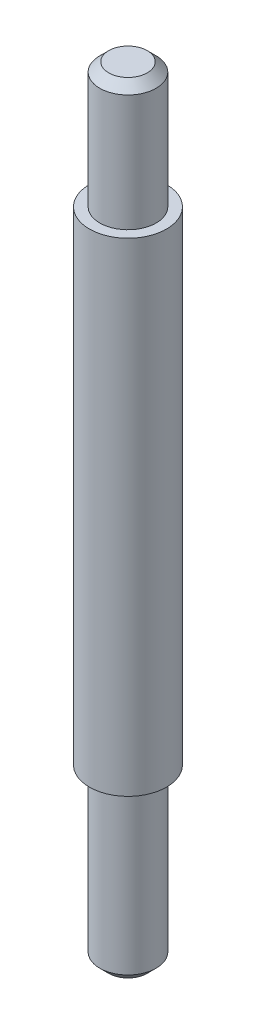
from build123d import *


with BuildPart() as part:
    # Sketch1 → Revolve1 (revolve)
    with BuildSketch(Plane(origin=(0, 0, 0), x_dir=(0, 0, -1), z_dir=(1, 0, 0))):
        Polygon((0, 1.400039432), (-0.065, 1.400039432), (-0.095, 1.370039432), (-0.095, 0.976440754), (-0.13, 0.976440754), (-0.13, -0.653559246), (-0.095, -0.653559246), (-0.095, -1.199960568), (-0.065, -1.229960568), (0, -1.229960568), align=None)
    revolve(axis=Axis((0, 1.400039432, 0), (0, -1, 0)))


solid = part.part
